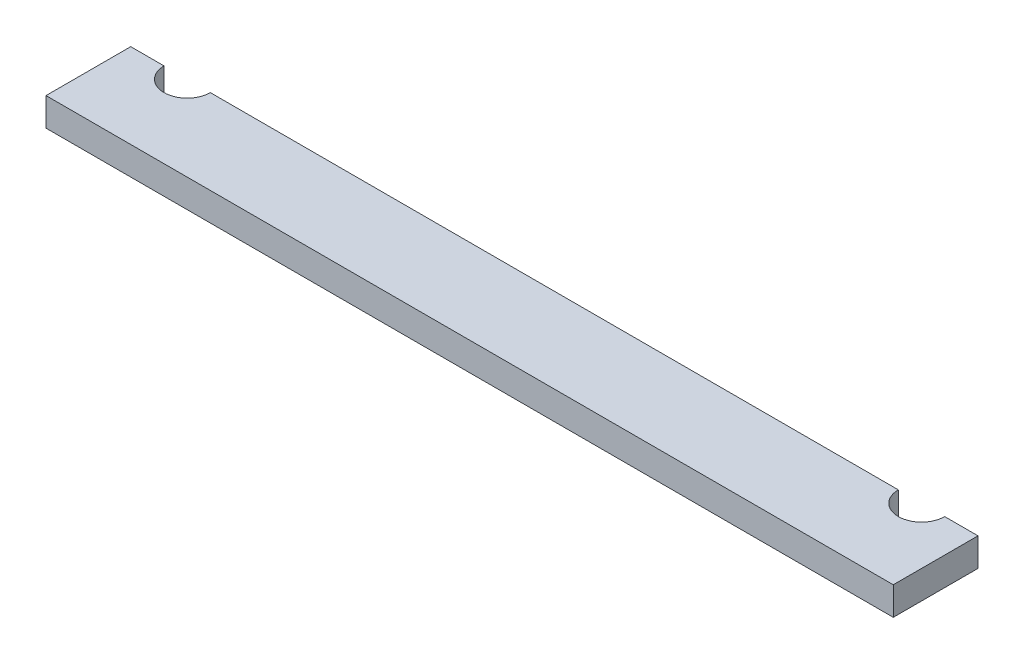
from build123d import *

# Parameters (mm, degrees)
BOSS_EXTRUDE1_DEPTH = 5


with BuildPart() as part:
    # Sketch1 → Boss-Extrude1 (new body)
    with BuildSketch(Plane(origin=(0, 0, 0), x_dir=(1, 0, 0), z_dir=(0, 1, 0))):
        with BuildLine():
            Line((75, -15), (75, 0))
            Line((75, 0), (14.1, 0))
            ThreePointArc((14.1, 0), (10, -4.1), (5.9, 0))
            Line((5.9, 0), (0, 0))
            Line((0, 0), (0, -15))
            Line((0, -15), (75, -15))
        make_face()
        with BuildLine():
            Line((135.9, 0), (75, 0))
            Line((75, 0), (75, -15))
            Line((75, -15), (150, -15))
            Line((150, -15), (150, 0))
            Line((150, 0), (144.1, 0))
            ThreePointArc((144.1, 0), (140, -4.1), (135.9, 0))
        make_face()
    extrude(amount=BOSS_EXTRUDE1_DEPTH)


solid = part.part
